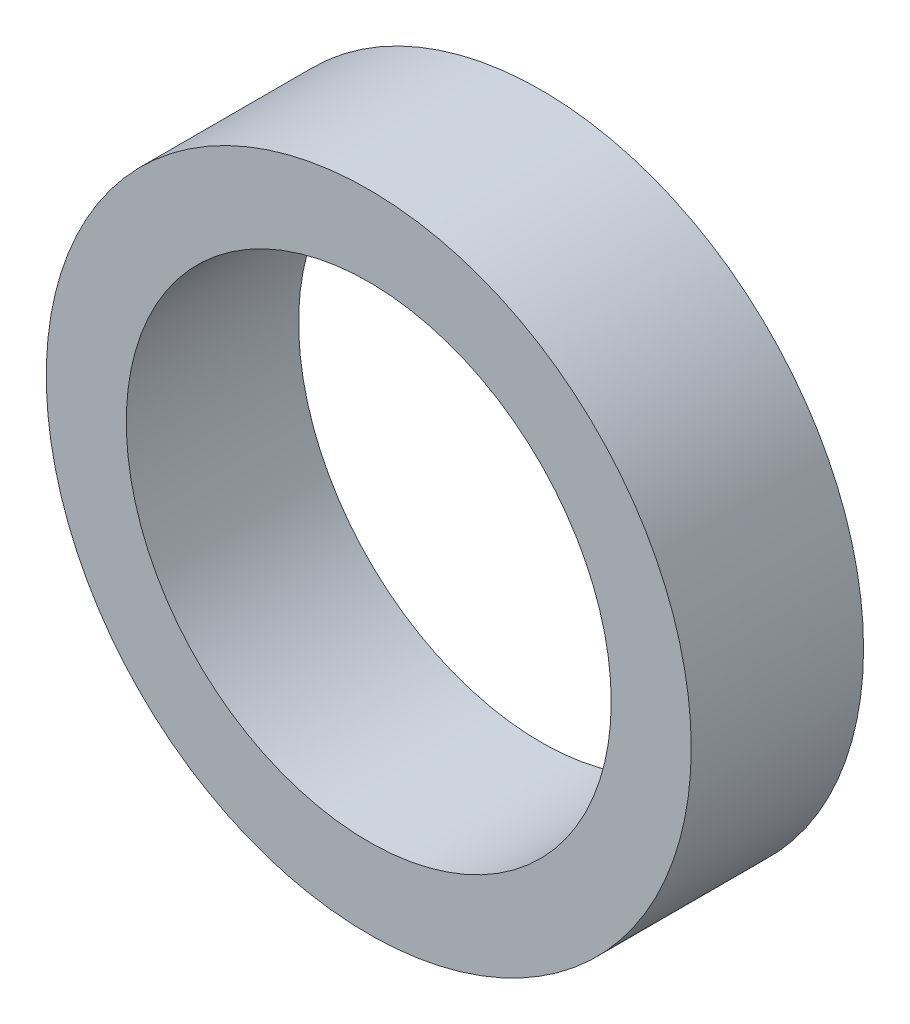
from build123d import *

# Parameters (mm, degrees)
CROQUIS1_R              = 65.5
CROQUIS1_R_2            = 49.25
SALIENTE_EXTRUIR1_DEPTH = 35


with BuildPart() as part:
    # Croquis1 → Saliente-Extruir1 (new body)
    with BuildSketch(Plane.XY):
        Circle(CROQUIS1_R)
        Circle(CROQUIS1_R_2, mode=Mode.SUBTRACT)
    extrude(amount=SALIENTE_EXTRUIR1_DEPTH)


solid = part.part
